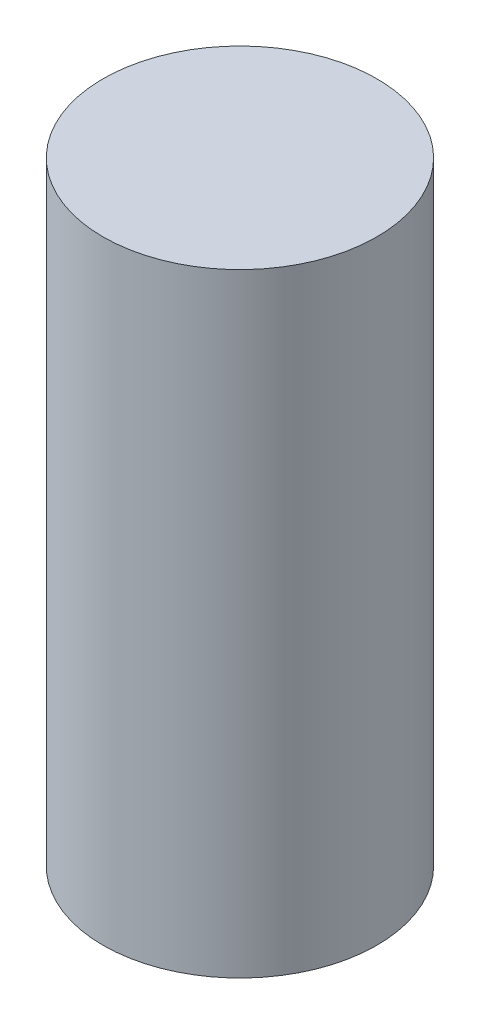
from build123d import *

# Parameters (mm, degrees)
SKETCH1_R           = 31.25
BOSS_EXTRUDE1_DEPTH = 140


with BuildPart() as part:
    # Sketch1 → Boss-Extrude1 (new body)
    with BuildSketch(Plane(origin=(0, 0, 0), x_dir=(1, 0, 0), z_dir=(0, 1, 0))):
        with Locations(Location((0, 0, 0), (0, 0, 270))):
            Circle(SKETCH1_R)
    extrude(amount=BOSS_EXTRUDE1_DEPTH)


solid = part.part
